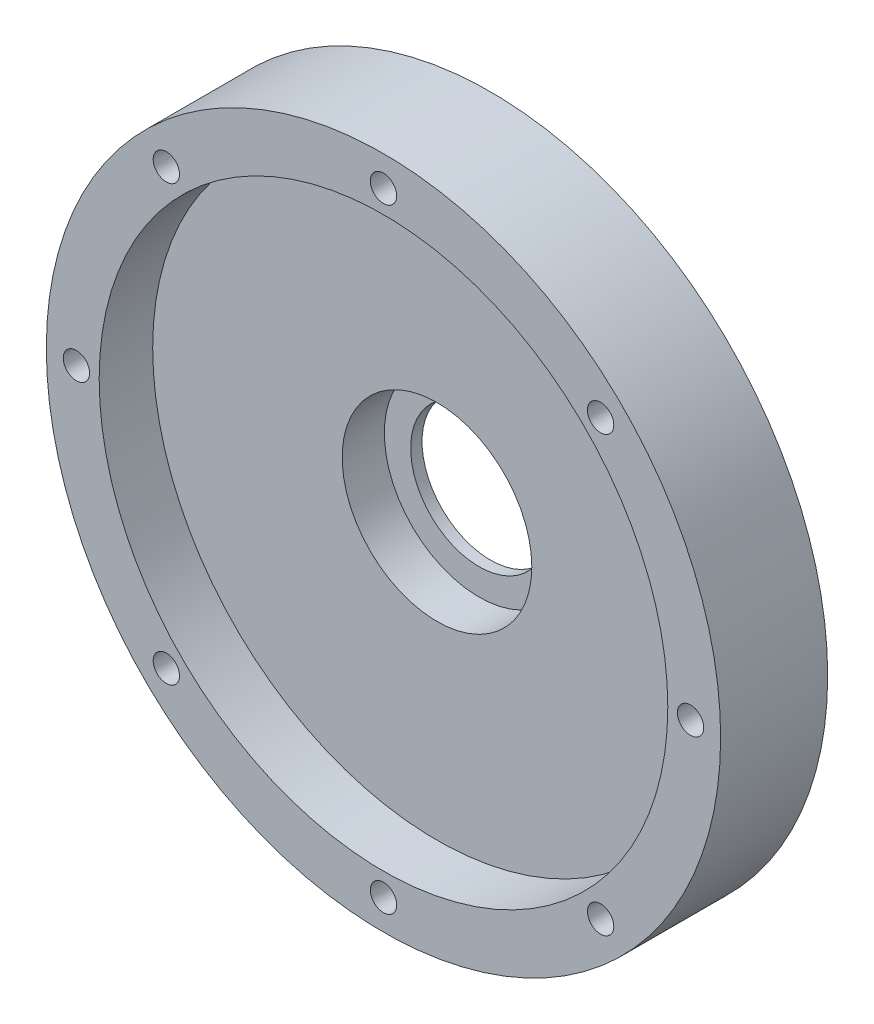
from build123d import *

# Parameters (mm, degrees)
SKETCH1_R             = 32.004
BOSS_EXTRUDE1_DEPTH   = 10.16
SKETCH2_R             = 26.9875
CUT_EXTRUDE1_DEPTH    = 5.08
SKETCH3_R             = 9
CUT_EXTRUDE2_DEPTH    = 4
SKETCH4_R             = 6.5
CUT_EXTRUDE3_DEPTH    = 47.162305315
M3X0_5_TAPPED_HOLE1_D = 2.5


with BuildPart() as part:
    # Sketch1 → Boss-Extrude1 (new body)
    with BuildSketch(Plane.XY):
        Circle(SKETCH1_R)
    extrude(amount=BOSS_EXTRUDE1_DEPTH)

    # Sketch2 → Cut-Extrude1 (cut)
    with BuildSketch(Plane.XY.offset(10.16)):
        Circle(SKETCH2_R)
    extrude(amount=-CUT_EXTRUDE1_DEPTH, mode=Mode.SUBTRACT)

    # Sketch3 → Cut-Extrude2 (cut)
    with BuildSketch(Plane.XY.offset(5.08)):
        Circle(SKETCH3_R)
    extrude(amount=-CUT_EXTRUDE2_DEPTH, mode=Mode.SUBTRACT)

    # Sketch4 → Cut-Extrude3 (cut, through all)
    with BuildSketch(Plane.XY.offset(1.08)):
        Circle(SKETCH4_R)
    extrude(amount=-CUT_EXTRUDE3_DEPTH, mode=Mode.SUBTRACT)

    # M3x0.5 Tapped Hole1 (through all)
    with Locations(Plane.XY.offset(10.16)):
        with Locations((-20.609687798, 20.609687798), (0, 29.1465), (20.609687798, 20.609687798), (29.1465, 0), (20.609687798, -20.609687798), (0, -29.1465), (-20.609687798, -20.609687798), (-29.1465, 0)):
            Hole(M3X0_5_TAPPED_HOLE1_D / 2)


solid = part.part
